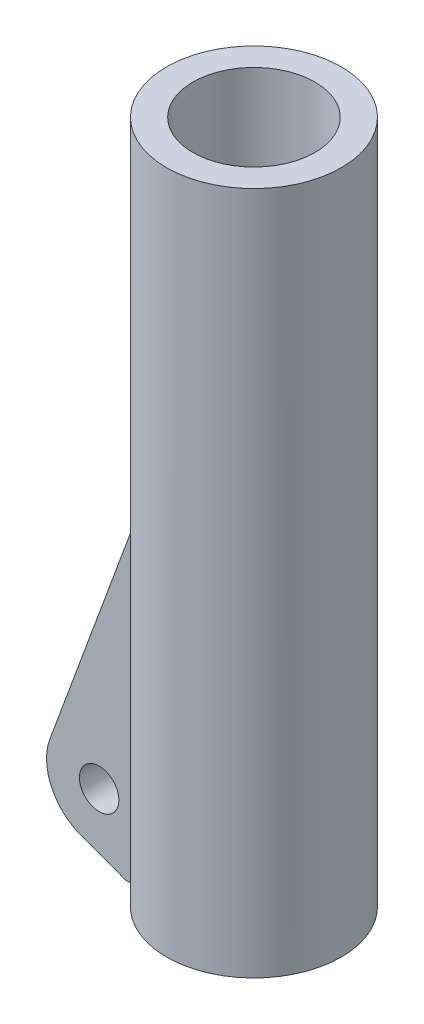
from build123d import *

# Parameters (mm, degrees)
SKETCH1_R           = 42.164
SKETCH1_R_2         = 29.464
BOSS_EXTRUDE1_DEPTH = 164.973
SKETCH2_R           = 9.525
BOSS_EXTRUDE2_DEPTH = 19.84375


with BuildPart() as part:
    # Sketch1 → Boss-Extrude1 (new, symmetric)
    with BuildSketch(Plane(origin=(0, 0, 0), x_dir=(1, 0, 0), z_dir=(0, 1, 0))):
        with Locations(Location((0, 0, 0), (0, 0, 90))):
            Circle(SKETCH1_R)
        with Locations(Location((0, 0, 0), (0, 0, 90))):
            Circle(SKETCH1_R_2, mode=Mode.SUBTRACT)
    extrude(amount=BOSS_EXTRUDE1_DEPTH, both=True)

    # Sketch2 → Boss-Extrude2 (add, symmetric)
    with BuildSketch(Plane.XY):
        with BuildLine():
            Line((-63.646931448, -157.056172579), (-42.164, -164.973))
            Line((-42.164, -164.973), (-29.464, -164.973))
            Line((-29.464, -164.973), (-29.464, 9.158002397))
            Line((-29.464, 9.158002397), (-78.697172579, -124.440068552))
            ThreePointArc((-78.697172579, -124.440068552), (-77.927068333, -143.865127562), (-63.646931448, -157.056172579))
        make_face()
        with Locations(Location((-54.864, -133.223, 0), (0, 0, 180))):
            Circle(SKETCH2_R, mode=Mode.SUBTRACT)
    extrude(amount=BOSS_EXTRUDE2_DEPTH, both=True)


solid = part.part
